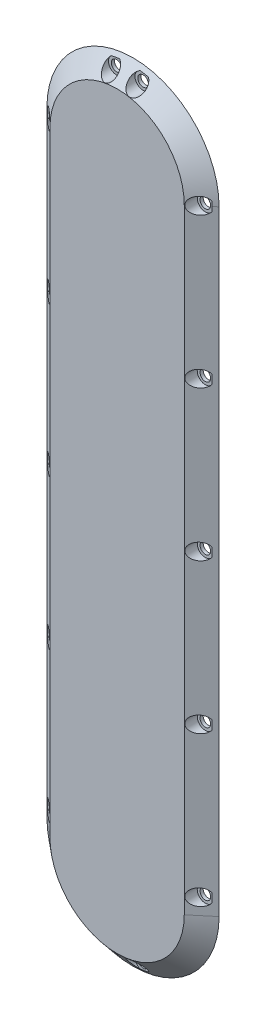
from build123d import *

# Parameters (mm, degrees)
BOSS_EXTRUDE1_DEPTH   = 6
BOSS_EXTRUDE1_TAPER   = 50
F_1_0MM_DOWEL_HOLE2_D = 4
F_4_0MM_DOWEL_HOLE1_D = 4
LPATTERN3_COUNT       = 5
LPATTERN3_PITCH       = 56.5
MIRROR2_COPY_1_D      = 4
MIRROR2_COPY_2_D      = 4
MIRROR2_COPY_3_D      = 4
MIRROR2_COPY_4_D      = 4
SKETCH8_R             = 3.05
CUT_EXTRUDE1_DEPTH    = 4.8


with BuildPart() as part:
    # Sketch1 → Boss-Extrude1 (new body)
    with BuildSketch(Plane.XY):
        with BuildLine():
            ThreePointArc((-32.5, -116), (0, -148.5), (32.5, -116))
            Line((32.5, -116), (32.5, 116))
            ThreePointArc((32.5, 116), (0, 148.5), (-32.5, 116))
            Line((-32.5, 116), (-32.5, -116))
        make_face()
    extrude(amount=BOSS_EXTRUDE1_DEPTH, taper=BOSS_EXTRUDE1_TAPER)

    # Ø1.0mm Dowel Hole2 (through all)
    with Locations(Plane.XY.offset(6)):
        with Locations((-5, 144), (5, 144)):
            f_1_0mm_dowel_hole2 = Hole(F_1_0MM_DOWEL_HOLE2_D / 2)

    # Mirror1: Ø1.0mm Dowel Hole2 across plane
    add(f_1_0mm_dowel_hole2.mirror(Plane.ZX), mode=Mode.SUBTRACT)

    # Ø4.0mm Dowel Hole1 (through all)
    with Locations(Plane.XY.offset(6)):
        with Locations((28.5, 116)):
            f_4_0mm_dowel_hole1 = Hole(F_4_0MM_DOWEL_HOLE1_D / 2)

    # LPattern3: Ø4.0mm Dowel Hole1 ×5
    with Locations(*[(0, -i * LPATTERN3_PITCH, 0) for i in range(1, LPATTERN3_COUNT)]):
        add(f_4_0mm_dowel_hole1, mode=Mode.SUBTRACT)

    # Mirror2: Ø4.0mm Dowel Hole1 across plane
    add(f_4_0mm_dowel_hole1.mirror(Plane(origin=(0, 0, 0), x_dir=(0, 0, 1), z_dir=(1, 0, 0))), mode=Mode.SUBTRACT)

    # Mirror2 copy 1 (through all)
    with Locations(Plane(origin=(0, -56.5, 6), x_dir=(-1, 0, 0), z_dir=(0, 0, 1))):
        with Locations((28.5, -116)):
            Hole(MIRROR2_COPY_1_D / 2)

    # Mirror2 copy 2 (through all)
    with Locations(Plane(origin=(0, -113, 6), x_dir=(-1, 0, 0), z_dir=(0, 0, 1))):
        with Locations((28.5, -116)):
            Hole(MIRROR2_COPY_2_D / 2)

    # Mirror2 copy 3 (through all)
    with Locations(Plane(origin=(0, -169.5, 6), x_dir=(-1, 0, 0), z_dir=(0, 0, 1))):
        with Locations((28.5, -116)):
            Hole(MIRROR2_COPY_3_D / 2)

    # Mirror2 copy 4 (through all)
    with Locations(Plane(origin=(0, -226, 6), x_dir=(-1, 0, 0), z_dir=(0, 0, 1))):
        with Locations((28.5, -116)):
            Hole(MIRROR2_COPY_4_D / 2)

    # Sketch8 → Cut-Extrude1 (cut)
    with BuildSketch(Plane.XY.offset(6)):
        with Locations((-28.5, 116)):
            Circle(SKETCH8_R)
        with Locations((-28.5, 59.5)):
            Circle(SKETCH8_R)
        with Locations((28.5, 59.5)):
            Circle(SKETCH8_R)
        with Locations((28.5, 116)):
            Circle(SKETCH8_R)
        with Locations((28.5, 3)):
            Circle(SKETCH8_R)
        with Locations((-28.5, 3)):
            Circle(SKETCH8_R)
        with Locations((28.5, -53.5)):
            Circle(SKETCH8_R)
        with Locations((-28.5, -53.5)):
            Circle(SKETCH8_R)
        with Locations((-28.5, -110)):
            Circle(SKETCH8_R)
        with Locations((28.5, -110)):
            Circle(SKETCH8_R)
        with Locations((5, -144)):
            Circle(SKETCH8_R)
        with Locations((-5, -144)):
            Circle(SKETCH8_R)
        with Locations((-5, 144)):
            Circle(SKETCH8_R)
        with Locations((5, 144)):
            Circle(SKETCH8_R)
    extrude(amount=-CUT_EXTRUDE1_DEPTH, mode=Mode.SUBTRACT)


solid = part.part
